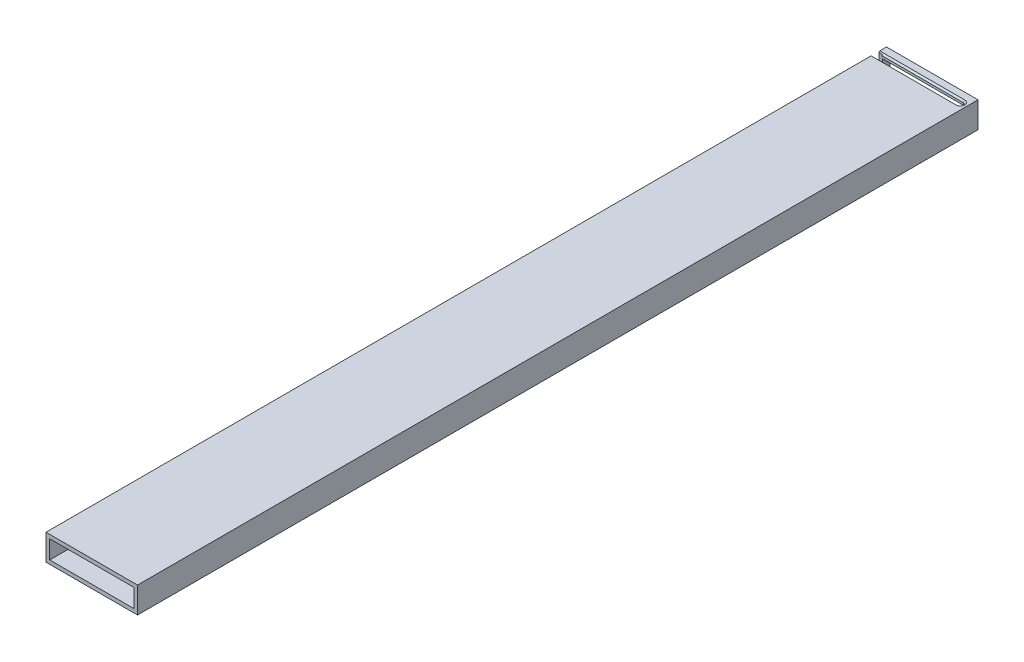
from build123d import *

# Parameters (mm, degrees)
SCHIZZO1_W                   = 35.931818182
SCHIZZO1_H                   = 10.2
SCHIZZO1_W_2                 = 33
SCHIZZO1_H_2                 = 7.2
ESTRUSIONE_ESTRUSIONE1_DEPTH = 330
SCHIZZO3_W                   = 2.7
SCHIZZO3_H                   = 3.2
TAGLIO_ESTRUSIONE1_DEPTH     = 34.465909091
TAGLIO_ESTRUSIONE2_DEPTH     = 1.5
SMUSSO2_SIZE                 = 0.6


with BuildPart() as part:
    # Schizzo1 → Estrusione-Estrusione1 (new body)
    with BuildSketch(Plane.XY):
        Rectangle(SCHIZZO1_W, SCHIZZO1_H)
        Rectangle(SCHIZZO1_W_2, SCHIZZO1_H_2, mode=Mode.SUBTRACT)
    extrude(amount=ESTRUSIONE_ESTRUSIONE1_DEPTH)

    # Schizzo3 → Taglio-Estrusione1 (cut)
    with BuildSketch(Plane.ZY.offset(17.965909091)):
        with Locations((4.35, 2)):
            Rectangle(SCHIZZO3_W, SCHIZZO3_H)
    extrude(amount=-TAGLIO_ESTRUSIONE1_DEPTH, mode=Mode.SUBTRACT)

    # Schizzo4 → Taglio-Estrusione2 (cut)
    with BuildSketch(Plane(origin=(0, 5.1, 0), x_dir=(1, 0, 0), z_dir=(0, 1, 0))):
        with BuildLine():
            Line((-16.5, -5.45), (15.4, -5.45))
            ThreePointArc((15.4, -5.45), (16.5, -4.35), (15.4, -3.25))
            Line((15.4, -3.25), (-16.5, -3.25))
            Line((-16.5, -3.25), (-16.5, -3))
            Line((-16.5, -3), (-17.965909091, -3))
            Line((-17.965909091, -3), (-17.965909091, -5.7))
            Line((-17.965909091, -5.7), (-16.5, -5.7))
            Line((-16.5, -5.7), (-16.5, -5.45))
        make_face()
    extrude(amount=-TAGLIO_ESTRUSIONE2_DEPTH, mode=Mode.SUBTRACT)

    # Smusso2
    smusso2_edges = [part.edges().sort_by_distance(p)[0] for p in [
        (-0.55, 5.1, 3.25),
        (16.5, 5.1, 4.35),
        (-0.55, 5.1, 5.45),
    ]]
    chamfer(smusso2_edges, length=SMUSSO2_SIZE)


solid = part.part
